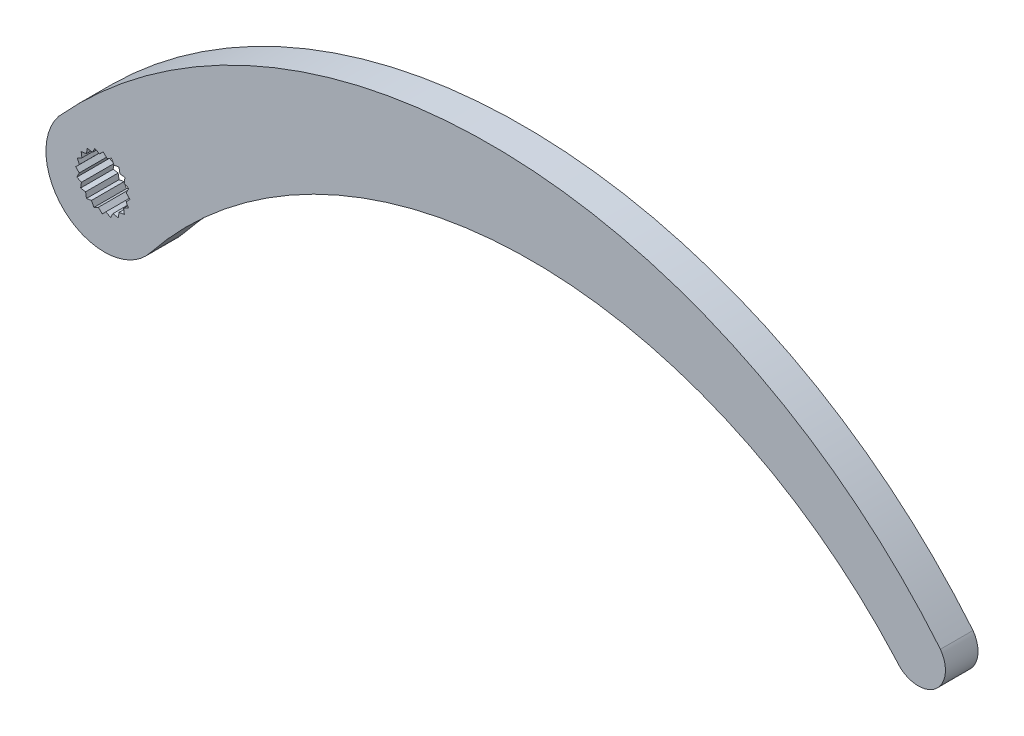
from build123d import *

# Parameters (mm, degrees)
BOSS_EXTRUDE1_DEPTH = 3


with BuildPart() as part:
    # Sketch3 → Boss-Extrude1 (new body)
    with BuildSketch(Plane.XY):
        with BuildLine():
            ThreePointArc((-21.06925633, 1.560185503), (-21.702383426, -4.120337722), (-16.861546239, -7.159332517))
            Line((-16.861546239, -7.159332517), (-16.235942246, -7.122800897))
            ThreePointArc((-16.235942246, -7.122800897), (-14.247317716, -6.480760333), (-12.653836147, -5.128850538))
            ThreePointArc((-12.653836147, -5.128850538), (21.262556938, 11.81913919), (56.062735888, -3.230898045))
            ThreePointArc((56.062735888, -3.230898045), (59.548283557, -3.823314658), (60.140700171, -0.337766989))
            ThreePointArc((60.140700171, -0.337766989), (19.96998669, 19.192613792), (-21.06925633, 1.560185503))
        make_face()
        Polygon((-14.842971244, -1.436629161), (-14.495267888, -1.784332517), (-14.848821278, -2.137885908), (-14.637840313, -2.550832882), (-15.083092963, -2.778319315), (-15.00954079, -3.236171091), (-15.503211236, -3.315477399), (-15.574237606, -3.773727796), (-16.068337858, -3.697144889), (-16.277038544, -4.111248976), (-16.723538831, -3.886221213), (-17.049626765, -4.215925369), (-17.405124343, -3.864326917), (-17.816901648, -4.077581746), (-18.046839834, -3.633590269), (-18.504279068, -3.70966601), (-18.586306367, -3.21644038), (-19.04494145, -3.147941973), (-18.971084274, -2.65342694), (-19.386332882, -2.447012878), (-19.163770631, -1.999278532), (-19.495267888, -1.67501361), (-19.145635065, -1.317582653), (-19.361157273, -0.906987537), (-18.918440472, -0.674604591), (-18.997037466, -0.217591808), (-18.504271649, -0.132846012), (-18.438303288, 0.326159812), (-17.94338851, 0.255030612), (-17.73926735, 0.671411115), (-17.290312559, 0.451321143), (-16.967880508, 0.784601421), (-16.60852704, 0.436944858), (-16.199126599, 0.654727893), (-15.964305958, 0.213299227), (-15.507733522, 0.294415085), (-15.420271807, -0.197875935), (-14.960909199, -0.261312244), (-15.029308259, -0.756611718), (-14.611808522, -0.958433771), align=None, mode=Mode.SUBTRACT)
    extrude(amount=BOSS_EXTRUDE1_DEPTH)


solid = part.part
